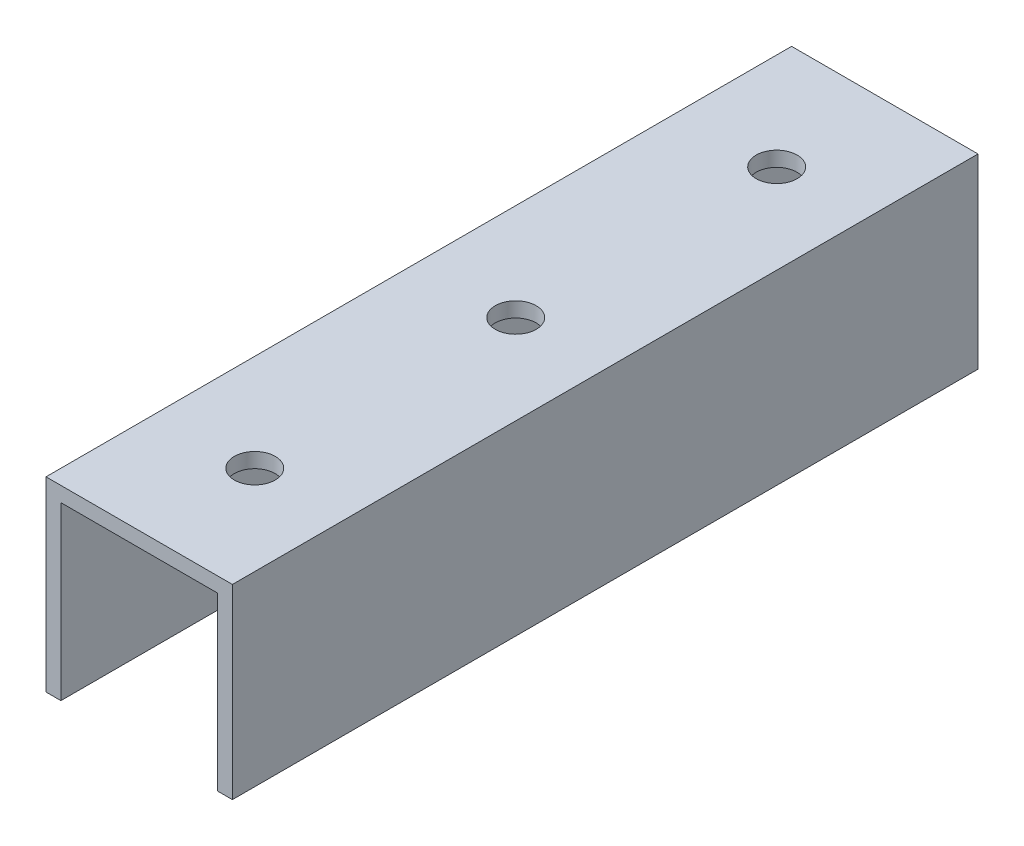
from build123d import *

# Parameters (mm, degrees)
DODANIE_WYCI_GNI_CIE1_DEPTH = 100
M5_CLEARANCE_HOLE1_D        = 5.5


with BuildPart() as part:
    # Szkic1 → Dodanie-wyciągnięcie1 (new body)
    with BuildSketch(Plane.XY):
        Polygon((0, 0), (0, 25), (25, 25), (25, 0), (23, 0), (23, 23), (2, 23), (2, 0), align=None)
    extrude(amount=DODANIE_WYCI_GNI_CIE1_DEPTH)

    # M5 Clearance Hole1 (through all)
    with Locations(Plane(origin=(0, 25, 0), x_dir=(1, 0, 0), z_dir=(0, 1, 0))):
        with Locations((13, -50), (13, -15), (13, -85)):
            Hole(M5_CLEARANCE_HOLE1_D / 2)


solid = part.part
